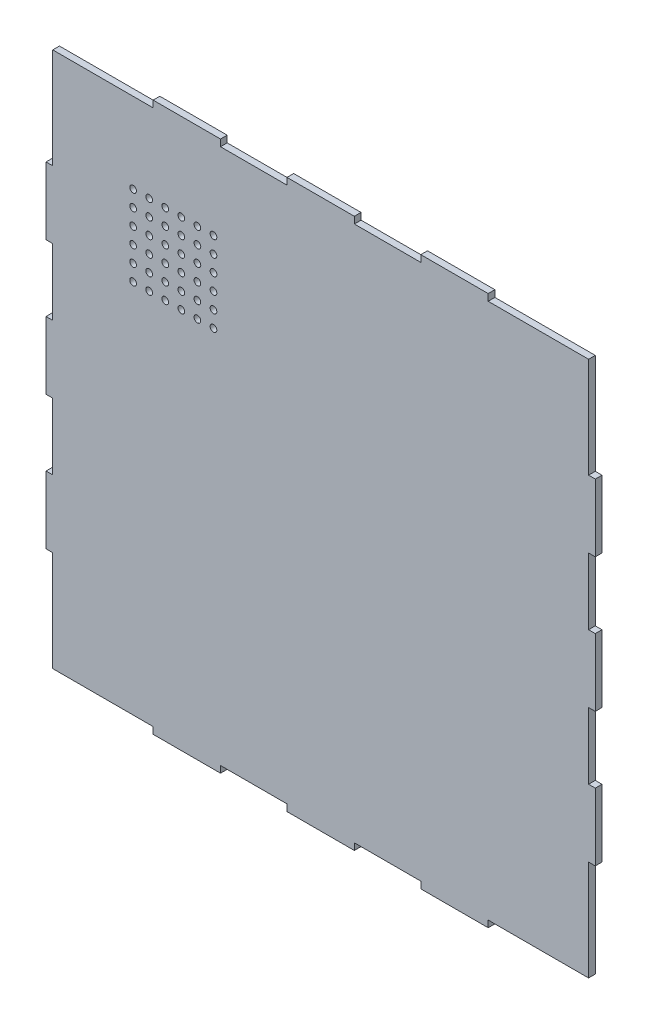
from build123d import *

# Parameters (mm, degrees)
SKIZZE1_W                       = 410
SKIZZE1_H                       = 410
AUFSATZ_LINEAR_AUSTRAGEN1_DEPTH = 5
SKIZZE2_W                       = 97.796702903
SKIZZE2_H                       = 49.6
SCHNITT_LINEAR_AUSTRAGEN1_DEPTH = 5
LINEARES_MUSTER1_COUNT          = 4
LINEARES_MUSTER1_PITCH          = 99.9
SPIEGELN1_COPY_1_SKETCH_W       = 97.796702903
SPIEGELN1_COPY_1_SKETCH_H       = 49.6
SPIEGELN1_COPY_1_DEPTH          = 5
SPIEGELN1_COPY_2_SKETCH_W       = 97.796702903
SPIEGELN1_COPY_2_SKETCH_H       = 49.6
SPIEGELN1_COPY_2_DEPTH          = 5
SPIEGELN1_COPY_3_SKETCH_W       = 97.796702903
SPIEGELN1_COPY_3_SKETCH_H       = 49.6
SPIEGELN1_COPY_3_DEPTH          = 5
SKIZZE3_W                       = 49.6
SKIZZE3_H                       = 41.77912255
SCHNITT_LINEAR_AUSTRAGEN2_DEPTH = 5
LINEARES_MUSTER2_COUNT          = 4
LINEARES_MUSTER2_PITCH          = 99.9
SPIEGELN2_COPY_1_SKETCH_W       = 49.6
SPIEGELN2_COPY_1_SKETCH_H       = 41.77912255
SPIEGELN2_COPY_1_DEPTH          = 5
SPIEGELN2_COPY_2_SKETCH_W       = 49.6
SPIEGELN2_COPY_2_SKETCH_H       = 41.77912255
SPIEGELN2_COPY_2_DEPTH          = 5
SPIEGELN2_COPY_3_SKETCH_W       = 49.6
SPIEGELN2_COPY_3_SKETCH_H       = 41.77912255
SPIEGELN2_COPY_3_DEPTH          = 5
SCHNITT_LINEAR_AUSTRAGEN3_DEPTH = 5
SPIEGELN4_COPY_1_DEPTH          = 5
SKIZZE5_R                       = 2.5
SCHNITT_LINEAR_AUSTRAGEN4_DEPTH = 10
LINEARES_MUSTER3_COUNT          = 6
LINEARES_MUSTER3_PITCH          = 12
LINEARES_MUSTER3_COUNT_DIR2     = 6
LINEARES_MUSTER3_PITCH_DIR2     = 12


with BuildPart() as part:
    # Skizze1 → Aufsatz-Linear austragen1 (new body)
    with BuildSketch(Plane.XY):
        with Locations((205, 205)):
            Rectangle(SKIZZE1_W, SKIZZE1_H)
    extrude(amount=AUFSATZ_LINEAR_AUSTRAGEN1_DEPTH)

    # Skizze2 → Schnitt-Linear austragen1 (cut)
    with BuildSketch(Plane.XY.offset(5)):
        with Locations((-43.898351452, 354.85)):
            Rectangle(SKIZZE2_W, SKIZZE2_H)
    schnitt_linear_austragen1 = extrude(amount=-SCHNITT_LINEAR_AUSTRAGEN1_DEPTH, mode=Mode.SUBTRACT)

    # Lineares Muster1: Schnitt-Linear austragen1 ×4
    with Locations(*[(0, -i * LINEARES_MUSTER1_PITCH, 0) for i in range(1, LINEARES_MUSTER1_COUNT)]):
        add(schnitt_linear_austragen1, mode=Mode.SUBTRACT)

    # Spiegeln1: Schnitt-Linear austragen1 across plane
    add(schnitt_linear_austragen1.mirror(Plane(origin=(205, 0, 0), x_dir=(0, 0, 1), z_dir=(1, 0, 0))), mode=Mode.SUBTRACT)

    # Spiegeln1 copy 1 sketch → Spiegeln1 copy 1 (cut)
    with BuildSketch(Plane(origin=(410, -99.9, 5), x_dir=(-1, 0, 0), z_dir=(0, 0, 1))):
        with Locations((-43.898351452, -354.85)):
            Rectangle(SPIEGELN1_COPY_1_SKETCH_W, SPIEGELN1_COPY_1_SKETCH_H)
    extrude(amount=-SPIEGELN1_COPY_1_DEPTH, mode=Mode.SUBTRACT)

    # Spiegeln1 copy 2 sketch → Spiegeln1 copy 2 (cut)
    with BuildSketch(Plane(origin=(410, -199.8, 5), x_dir=(-1, 0, 0), z_dir=(0, 0, 1))):
        with Locations((-43.898351452, -354.85)):
            Rectangle(SPIEGELN1_COPY_2_SKETCH_W, SPIEGELN1_COPY_2_SKETCH_H)
    extrude(amount=-SPIEGELN1_COPY_2_DEPTH, mode=Mode.SUBTRACT)

    # Spiegeln1 copy 3 sketch → Spiegeln1 copy 3 (cut)
    with BuildSketch(Plane(origin=(410, -299.7, 5), x_dir=(-1, 0, 0), z_dir=(0, 0, 1))):
        with Locations((-43.898351452, -354.85)):
            Rectangle(SPIEGELN1_COPY_3_SKETCH_W, SPIEGELN1_COPY_3_SKETCH_H)
    extrude(amount=-SPIEGELN1_COPY_3_DEPTH, mode=Mode.SUBTRACT)

    # Skizze3 → Schnitt-Linear austragen2 (cut)
    with BuildSketch(Plane.XY.offset(5)):
        with Locations((55.15, 425.889561275)):
            Rectangle(SKIZZE3_W, SKIZZE3_H)
    schnitt_linear_austragen2 = extrude(amount=-SCHNITT_LINEAR_AUSTRAGEN2_DEPTH, mode=Mode.SUBTRACT)

    # Lineares Muster2: Schnitt-Linear austragen2 ×4
    with Locations(*[(i * LINEARES_MUSTER2_PITCH, 0, 0) for i in range(1, LINEARES_MUSTER2_COUNT)]):
        add(schnitt_linear_austragen2, mode=Mode.SUBTRACT)

    # Spiegeln2: Schnitt-Linear austragen2 across plane
    add(schnitt_linear_austragen2.mirror(Plane.ZX.offset(205)), mode=Mode.SUBTRACT)

    # Spiegeln2 copy 1 sketch → Spiegeln2 copy 1 (cut)
    with BuildSketch(Plane(origin=(99.9, 410, 5), x_dir=(1, 0, 0), z_dir=(0, 0, 1))):
        with Locations((55.15, -425.889561275)):
            Rectangle(SPIEGELN2_COPY_1_SKETCH_W, SPIEGELN2_COPY_1_SKETCH_H)
    extrude(amount=-SPIEGELN2_COPY_1_DEPTH, mode=Mode.SUBTRACT)

    # Spiegeln2 copy 2 sketch → Spiegeln2 copy 2 (cut)
    with BuildSketch(Plane(origin=(199.8, 410, 5), x_dir=(1, 0, 0), z_dir=(0, 0, 1))):
        with Locations((55.15, -425.889561275)):
            Rectangle(SPIEGELN2_COPY_2_SKETCH_W, SPIEGELN2_COPY_2_SKETCH_H)
    extrude(amount=-SPIEGELN2_COPY_2_DEPTH, mode=Mode.SUBTRACT)

    # Spiegeln2 copy 3 sketch → Spiegeln2 copy 3 (cut)
    with BuildSketch(Plane(origin=(299.7, 410, 5), x_dir=(1, 0, 0), z_dir=(0, 0, 1))):
        with Locations((55.15, -425.889561275)):
            Rectangle(SPIEGELN2_COPY_3_SKETCH_W, SPIEGELN2_COPY_3_SKETCH_H)
    extrude(amount=-SPIEGELN2_COPY_3_DEPTH, mode=Mode.SUBTRACT)

    # Skizze4 → Schnitt-Linear austragen3 (cut)
    with BuildSketch(Plane.XY.offset(5)):
        Polygon((5, 379.65), (5, 405), (30.35, 405), (30.35, 431.549801047), (5, 431.549801047), (-47.862925009, 431.549801047), (-47.862925009, 405), (-47.862925009, 379.65), align=None)
    schnitt_linear_austragen3 = extrude(amount=-SCHNITT_LINEAR_AUSTRAGEN3_DEPTH, mode=Mode.SUBTRACT)

    # Spiegeln3: Schnitt-Linear austragen3 across plane
    add(schnitt_linear_austragen3.mirror(Plane(origin=(205, 0, 0), x_dir=(0, 0, 1), z_dir=(1, 0, 0))), mode=Mode.SUBTRACT)

    # Spiegeln4: Schnitt-Linear austragen3 across plane
    add(schnitt_linear_austragen3.mirror(Plane.ZX.offset(205)), mode=Mode.SUBTRACT)

    # Spiegeln4 copy 1 sketch → Spiegeln4 copy 1 (cut)
    with BuildSketch(Plane(origin=(410, 410, 5), x_dir=(-1, 0, 0), z_dir=(0, 0, 1))):
        Polygon((5, 379.65), (5, 405), (30.35, 405), (30.35, 431.549801047), (5, 431.549801047), (-47.862925009, 431.549801047), (-47.862925009, 405), (-47.862925009, 379.65), align=None)
    extrude(amount=-SPIEGELN4_COPY_1_DEPTH, mode=Mode.SUBTRACT)

    # Skizze5 → Schnitt-Linear austragen4 (cut)
    with BuildSketch(Plane.XY.offset(5)):
        with Locations((125, 285)):
            Circle(SKIZZE5_R)
    schnitt_linear_austragen4 = extrude(amount=-SCHNITT_LINEAR_AUSTRAGEN4_DEPTH, mode=Mode.SUBTRACT)

    # Lineares Muster3: Schnitt-Linear austragen4 6 × 6
    with Locations(*[(-j * LINEARES_MUSTER3_PITCH_DIR2, i * LINEARES_MUSTER3_PITCH, 0) for i in range(LINEARES_MUSTER3_COUNT) for j in range(LINEARES_MUSTER3_COUNT_DIR2) if (i, j) != (0, 0)]):
        add(schnitt_linear_austragen4, mode=Mode.SUBTRACT)


solid = part.part
